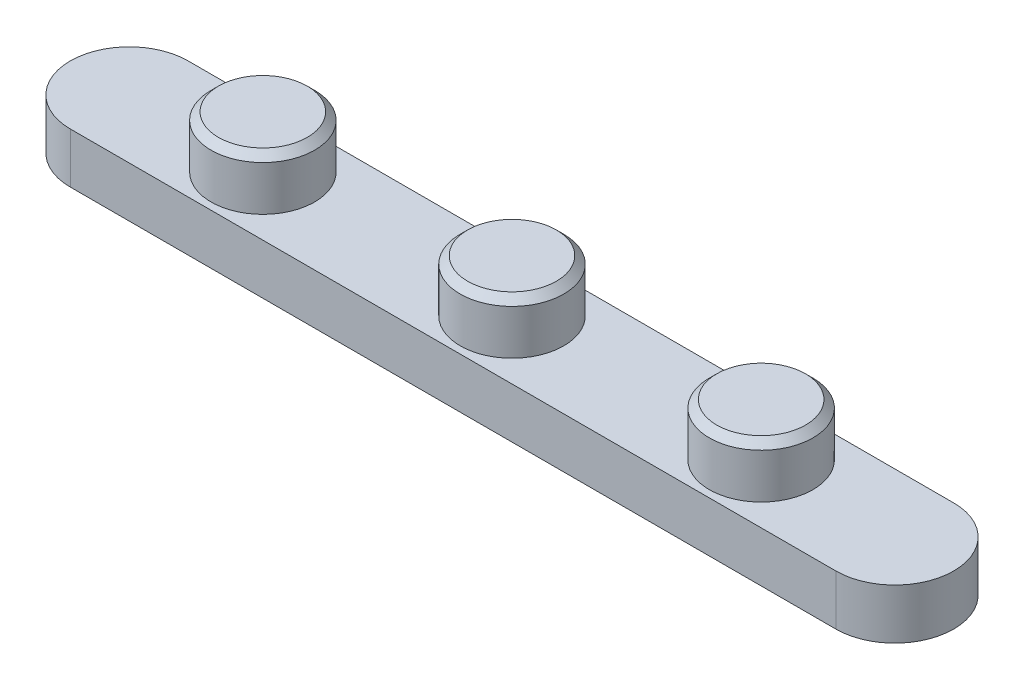
from build123d import *

# Parameters (mm, degrees)
BOSS_EXTRUDE1_DEPTH = 3.4
SKETCH1_3_R         = 3.5
BOSS_EXTRUDE2_DEPTH = 6.93
CHAMFER1_SIZE       = 0.5
SKETCH1_4_R         = 3.5
BOSS_EXTRUDE3_DEPTH = 6.93
CHAMFER2_SIZE       = 0.5


with BuildPart() as part:
    # Sketch1 → Boss-Extrude1 (new body)
    with BuildSketch(Plane(origin=(0, 0, 0), x_dir=(1, 0, 0), z_dir=(0, 1, 0))):
        with BuildLine():
            Line((-25.855, 3.98), (25.855, 3.98))
            ThreePointArc((25.855, 3.98), (29.835, 0), (25.855, -3.98))
            Line((25.855, -3.98), (-25.855, -3.98))
            ThreePointArc((-25.855, -3.98), (-29.835, 0), (-25.855, 3.98))
        make_face()
    extrude(amount=BOSS_EXTRUDE1_DEPTH)

    # Sketch1<3> → Boss-Extrude2 (add)
    with BuildSketch(Plane(origin=(0, 0, 0), x_dir=(1, 0, 0), z_dir=(0, 1, 0))):
        with Locations(Location((-16.8275, 0, 0), (0, 0, 90))):
            Circle(SKETCH1_3_R)
        with Locations(Location((16.8275, 0, 0), (0, 0, 90))):
            Circle(SKETCH1_3_R)
    extrude(amount=BOSS_EXTRUDE2_DEPTH)

    # Chamfer1
    chamfer1_edges = [part.edges().sort_by_distance(p)[0] for p in [
        (-16.8275, 6.93, 3.5),
        (16.8275, 6.93, 3.5),
    ]]
    chamfer(chamfer1_edges, length=CHAMFER1_SIZE)

    # Sketch1<4> → Boss-Extrude3 (add)
    with BuildSketch(Plane(origin=(0, 0, 0), x_dir=(1, 0, 0), z_dir=(0, 1, 0))):
        with Locations(Location((0, 0, 0), (0, 0, 90))):
            Circle(SKETCH1_4_R)
    extrude(amount=BOSS_EXTRUDE3_DEPTH)

    # Chamfer2
    chamfer2_edges = [part.edges().sort_by_distance(p)[0] for p in [
        (0, 6.93, 3.5),
    ]]
    chamfer(chamfer2_edges, length=CHAMFER2_SIZE)


solid = part.part
